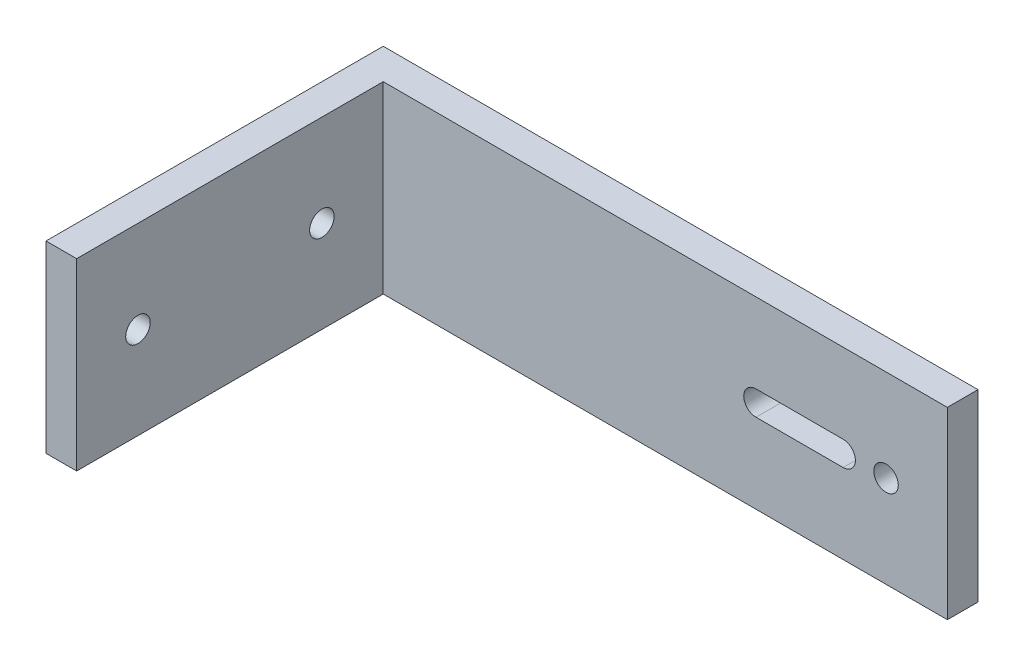
from build123d import *

# Parameters (mm, degrees)
SKETCH1_W           = 97
SKETCH1_H           = 30
BOSS_EXTRUDE1_DEPTH = 5
SKETCH2_R           = 2
CUT_EXTRUDE1_DEPTH  = 52.01225343
SKETCH3_W           = 5
SKETCH3_H           = 30
BOSS_EXTRUDE2_DEPTH = 50
SKETCH4_R           = 2
CUT_EXTRUDE2_DEPTH  = 113.512221558


with BuildPart() as part:
    # Sketch1 → Boss-Extrude1 (new body)
    with BuildSketch(Plane.XY):
        Rectangle(SKETCH1_W, SKETCH1_H)
    extrude(amount=BOSS_EXTRUDE1_DEPTH)

    # Sketch2 → Cut-Extrude1 (cut, through all)
    with BuildSketch(Plane.XY.offset(5)):
        with Locations((38.5, 0)):
            Circle(SKETCH2_R)
        with BuildLine():
            Line((17.292206758, 2), (31.5, 2))
            ThreePointArc((31.5, 2), (33.5, 0), (31.5, -2))
            Line((31.5, -2), (17.292206758, -2))
            ThreePointArc((17.292206758, -2), (15.292206758, 0), (17.292206758, 2))
        make_face()
    extrude(amount=-CUT_EXTRUDE1_DEPTH, mode=Mode.SUBTRACT)

    # Sketch3 → Boss-Extrude2 (add)
    with BuildSketch(Plane.XY.offset(5)):
        with Locations((-46, 0)):
            Rectangle(SKETCH3_W, SKETCH3_H)
    extrude(amount=BOSS_EXTRUDE2_DEPTH)

    # Sketch4 → Cut-Extrude2 (cut, through all)
    with BuildSketch(Plane.ZY.offset(48.5)):
        with Locations(Location((15, 0, 0), (0, 0, 270))):
            Circle(SKETCH4_R)
        with Locations(Location((45, 0, 0), (0, 0, 270))):
            Circle(SKETCH4_R)
    extrude(amount=-CUT_EXTRUDE2_DEPTH, mode=Mode.SUBTRACT)


solid = part.part
